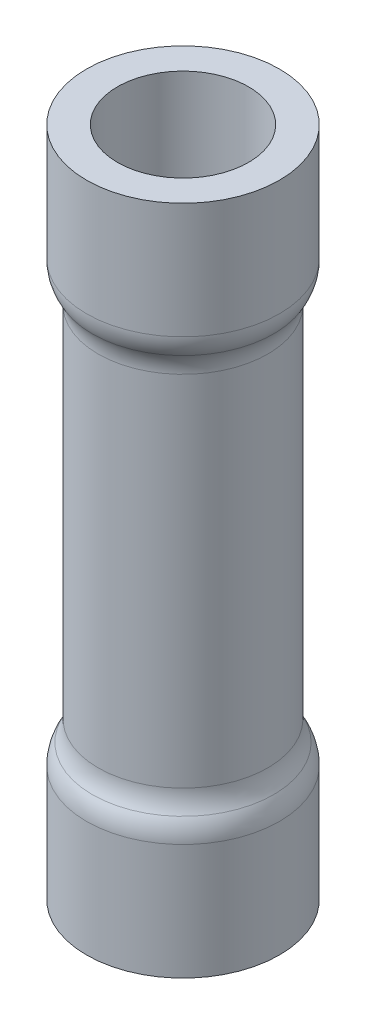
from build123d import *


with BuildPart() as part:
    # Sketch1 → Revolve-Thin1 (revolve)
    with BuildSketch(Plane.XY, mode=Mode.PRIVATE) as revolve_thin1_sk:
        with BuildLine():
            Line((3.175, 22.098), (3.175, 18.288))
            ThreePointArc((3.175, 18.288), (3.126446888, 17.940196176), (2.9845, 17.618985987))
            ThreePointArc((2.9845, 17.618985987), (2.842553112, 17.297775797), (2.794, 16.949971973))
            Line((2.794, 16.949971973), (2.794, 5.148028027))
            ThreePointArc((2.794, 5.148028027), (2.842553112, 4.800224203), (2.9845, 4.479014013))
            ThreePointArc((2.9845, 4.479014013), (3.126446888, 4.157803824), (3.175, 3.81))
            Line((3.175, 3.81), (3.175, 0))
            Line((3.175, 0), (2.159, 0))
            Line((2.159, 0), (2.159, 3.81))
            ThreePointArc((2.159, 3.81), (2.149289378, 3.879560765), (2.1209, 3.943802803))
            ThreePointArc((2.1209, 3.943802803), (1.865395602, 4.521981143), (1.778, 5.148028027))
            Line((1.778, 5.148028027), (1.778, 16.949971973))
            ThreePointArc((1.778, 16.949971973), (1.865395602, 17.576018857), (2.1209, 18.154197197))
            ThreePointArc((2.1209, 18.154197197), (2.149289378, 18.218439235), (2.159, 18.288))
            Line((2.159, 18.288), (2.159, 22.098))
            Line((2.159, 22.098), (3.175, 22.098))
        make_face()
    revolve(revolve_thin1_sk.sketch.rotate(Axis((0, 22.098, 0), (0, -1, 0)), 90), axis=Axis((0, 22.098, 0), (0, -1, 0)))


solid = part.part
